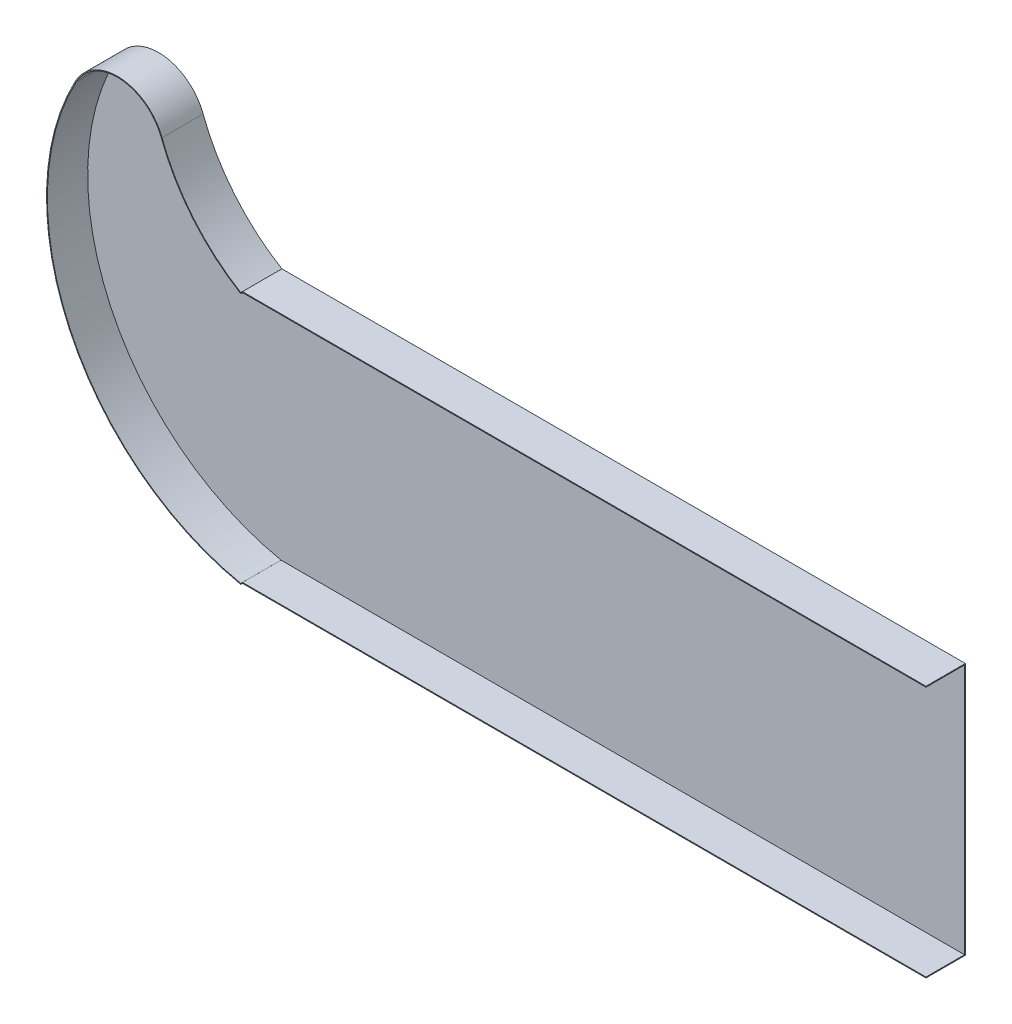
from build123d import *

# Parameters (mm, degrees)
SKETCH_1_W          = 1596
SKETCH_1_H          = 590
EXTRUDE_1_DEPTH     = 2
EXTRUDE_2_DEPTH     = 90
EXTRUDE_5_DEPTH     = 96
CUT_EXTRUDE_1_DEPTH = 94


with BuildPart() as part:
    # 草图1 → 凸台-拉伸1 (new body)
    with BuildSketch(Plane.XY):
        Rectangle(SKETCH_1_W, SKETCH_1_H)
    extrude(amount=EXTRUDE_1_DEPTH)

    # 草图2 → 凸台-拉伸2 (add)
    with BuildSketch(Plane.XY.offset(2)):
        Polygon((-798, -293), (796, -293), (798, -293), (798, -295), (-798, -295), align=None)
        Polygon((796, 293), (798, 293), (798, 295), (-798, 295), (-798, 293), align=None)
    extrude(amount=EXTRUDE_2_DEPTH)

    # 草图5 → 凸台-拉伸5 (add)
    with BuildSketch(Plane(origin=(0, 0, 0), x_dir=(-1, 0, 0), z_dir=(0, 0, -1))):
        with BuildLine():
            Line((798, 295), (798, -295))
            ThreePointArc((798, -295), (1198.010532784, 20.610905531), (1183.918362251, 529.943881843))
            ThreePointArc((1183.918362251, 529.943881843), (1078.504933407, 588.278536691), (981.833490458, 516.378918785))
            ThreePointArc((981.833490458, 516.378918785), (908.585128619, 390.187197034), (798, 295))
        make_face()
    extrude(amount=-EXTRUDE_5_DEPTH)

    # 草图6 → 切除-拉伸1 (cut)
    with BuildSketch(Plane.XY.offset(96)):
        with BuildLine():
            Line((-797.998398705, 292.662145907), (-797.597225993, -293.040976493))
            ThreePointArc((-797.597225993, -293.040976493), (-1196.198962172, 21.458379377), (-1182.156422838, 528.997536503))
            ThreePointArc((-1182.156422838, 528.997536503), (-1078.638882134, 586.283027298), (-983.706100418, 515.67654286))
            ThreePointArc((-983.706100418, 515.67654286), (-910.123787085, 388.909492011), (-799.034482428, 293.288320677))
            Line((-799.034482428, 293.288320677), (-797.998398705, 292.662145907))
        make_face()
    extrude(amount=-CUT_EXTRUDE_1_DEPTH, mode=Mode.SUBTRACT)


solid = part.part
